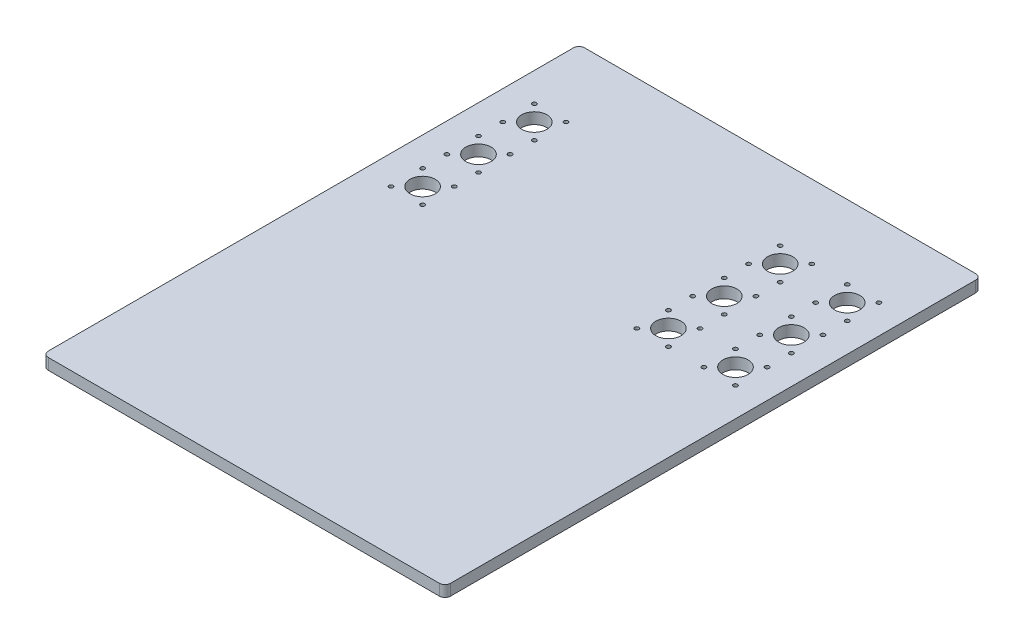
from build123d import *

# Parameters (mm, degrees)
SKETCH2_W           = 457.2
SKETCH2_H           = 609.6
BOSS_EXTRUDE1_DEPTH = 12.7
SKETCH3_R           = 14.3383
SKETCH3_R_2         = 2.38125
CUT_EXTRUDE1_DEPTH  = 382.211607903
FILLET1_R           = 6.35


with BuildPart() as part:
    # Sketch2 → Boss-Extrude1 (new body)
    with BuildSketch(Plane(origin=(0, 0, 0), x_dir=(1, 0, 0), z_dir=(0, 1, 0))):
        Rectangle(SKETCH2_W, SKETCH2_H)
    extrude(amount=BOSS_EXTRUDE1_DEPTH)

    # Sketch3 → Cut-Extrude1 (cut, through all)
    with BuildSketch(Plane(origin=(0, 12.7, 0), x_dir=(1, 0, 0), z_dir=(0, 1, 0))):
        with Locations(Location((-177.8, 203.2, 0), (0, 0, 270))):
            Circle(SKETCH3_R)
        with Locations(Location((-195.760512242, 221.160512242, 0), (0, 0, 270))):
            Circle(SKETCH3_R_2)
        with Locations(Location((-159.839487758, 221.160512242, 0), (0, 0, 270))):
            Circle(SKETCH3_R_2)
        with Locations(Location((-159.839487758, 185.239487758, 0), (0, 0, 270))):
            Circle(SKETCH3_R_2)
        with Locations(Location((-195.760512242, 185.239487758, 0), (0, 0, 270))):
            Circle(SKETCH3_R_2)
        with Locations(Location((195.760512242, 185.239487758, 0), (0, 0, 90))):
            Circle(SKETCH3_R_2)
        with Locations(Location((159.839487758, 185.239487758, 0), (0, 0, 90))):
            Circle(SKETCH3_R_2)
        with Locations(Location((159.839487758, 221.160512242, 0), (0, 0, 90))):
            Circle(SKETCH3_R_2)
        with Locations(Location((195.760512242, 221.160512242, 0), (0, 0, 90))):
            Circle(SKETCH3_R_2)
        with Locations(Location((177.8, 203.2, 0), (0, 0, 90))):
            Circle(SKETCH3_R)
        with Locations(Location((177.8, 139.7, 0), (0, 0, 270))):
            Circle(SKETCH3_R)
        with Locations(Location((195.760512242, 121.739487758, 0), (0, 0, 270))):
            Circle(SKETCH3_R_2)
        with Locations(Location((159.839487758, 121.739487758, 0), (0, 0, 270))):
            Circle(SKETCH3_R_2)
        with Locations(Location((159.839487758, 157.660512242, 0), (0, 0, 270))):
            Circle(SKETCH3_R_2)
        with Locations(Location((195.760512242, 157.660512242, 0), (0, 0, 270))):
            Circle(SKETCH3_R_2)
        with Locations(Location((-195.760512242, 157.660512242, 0), (0, 0, 90))):
            Circle(SKETCH3_R_2)
        with Locations(Location((-159.839487758, 157.660512242, 0), (0, 0, 90))):
            Circle(SKETCH3_R_2)
        with Locations(Location((-159.839487758, 121.739487758, 0), (0, 0, 90))):
            Circle(SKETCH3_R_2)
        with Locations(Location((-195.760512242, 121.739487758, 0), (0, 0, 90))):
            Circle(SKETCH3_R_2)
        with Locations(Location((-177.8, 139.7, 0), (0, 0, 90))):
            Circle(SKETCH3_R)
        with Locations(Location((177.8, 76.2, 0), (0, 0, 270))):
            Circle(SKETCH3_R)
        with Locations(Location((195.760512242, 58.239487758, 0), (0, 0, 270))):
            Circle(SKETCH3_R_2)
        with Locations(Location((159.839487758, 58.239487758, 0), (0, 0, 270))):
            Circle(SKETCH3_R_2)
        with Locations(Location((159.839487758, 94.160512242, 0), (0, 0, 270))):
            Circle(SKETCH3_R_2)
        with Locations(Location((195.760512242, 94.160512242, 0), (0, 0, 270))):
            Circle(SKETCH3_R_2)
        with Locations(Location((-195.760512242, 94.160512242, 0), (0, 0, 90))):
            Circle(SKETCH3_R_2)
        with Locations(Location((-159.839487758, 94.160512242, 0), (0, 0, 90))):
            Circle(SKETCH3_R_2)
        with Locations(Location((-159.839487758, 58.239487758, 0), (0, 0, 90))):
            Circle(SKETCH3_R_2)
        with Locations(Location((-195.760512242, 58.239487758, 0), (0, 0, 90))):
            Circle(SKETCH3_R_2)
        with Locations(Location((-177.8, 76.2, 0), (0, 0, 90))):
            Circle(SKETCH3_R)
        with Locations(Location((101.6, 76.2, 0), (0, 0, 270))):
            Circle(SKETCH3_R)
        with Locations(Location((119.560512242, 58.239487758, 0), (0, 0, 270))):
            Circle(SKETCH3_R_2)
        with Locations(Location((83.639487758, 58.239487758, 0), (0, 0, 270))):
            Circle(SKETCH3_R_2)
        with Locations(Location((83.639487758, 94.160512242, 0), (0, 0, 270))):
            Circle(SKETCH3_R_2)
        with Locations(Location((119.560512242, 94.160512242, 0), (0, 0, 270))):
            Circle(SKETCH3_R_2)
        with Locations(Location((101.6, 139.7, 0), (0, 0, 270))):
            Circle(SKETCH3_R)
        with Locations(Location((119.560512242, 121.739487758, 0), (0, 0, 270))):
            Circle(SKETCH3_R_2)
        with Locations(Location((83.639487758, 121.739487758, 0), (0, 0, 270))):
            Circle(SKETCH3_R_2)
        with Locations(Location((83.639487758, 157.660512242, 0), (0, 0, 270))):
            Circle(SKETCH3_R_2)
        with Locations(Location((119.560512242, 157.660512242, 0), (0, 0, 270))):
            Circle(SKETCH3_R_2)
        with Locations(Location((119.560512242, 185.239487758, 0), (0, 0, 90))):
            Circle(SKETCH3_R_2)
        with Locations(Location((83.639487758, 185.239487758, 0), (0, 0, 90))):
            Circle(SKETCH3_R_2)
        with Locations(Location((83.639487758, 221.160512242, 0), (0, 0, 90))):
            Circle(SKETCH3_R_2)
        with Locations(Location((119.560512242, 221.160512242, 0), (0, 0, 90))):
            Circle(SKETCH3_R_2)
        with Locations(Location((101.6, 203.2, 0), (0, 0, 90))):
            Circle(SKETCH3_R)
    extrude(amount=-CUT_EXTRUDE1_DEPTH, mode=Mode.SUBTRACT)

    # Fillet1
    fillet1_edges = [part.edges().sort_by_distance(p)[0] for p in [
        (228.6, 6.35, 304.8),
        (-228.6, 6.35, 304.8),
        (-228.6, 6.35, -304.8),
        (228.6, 6.35, -304.8),
    ]]
    fillet(fillet1_edges, radius=FILLET1_R)


solid = part.part
